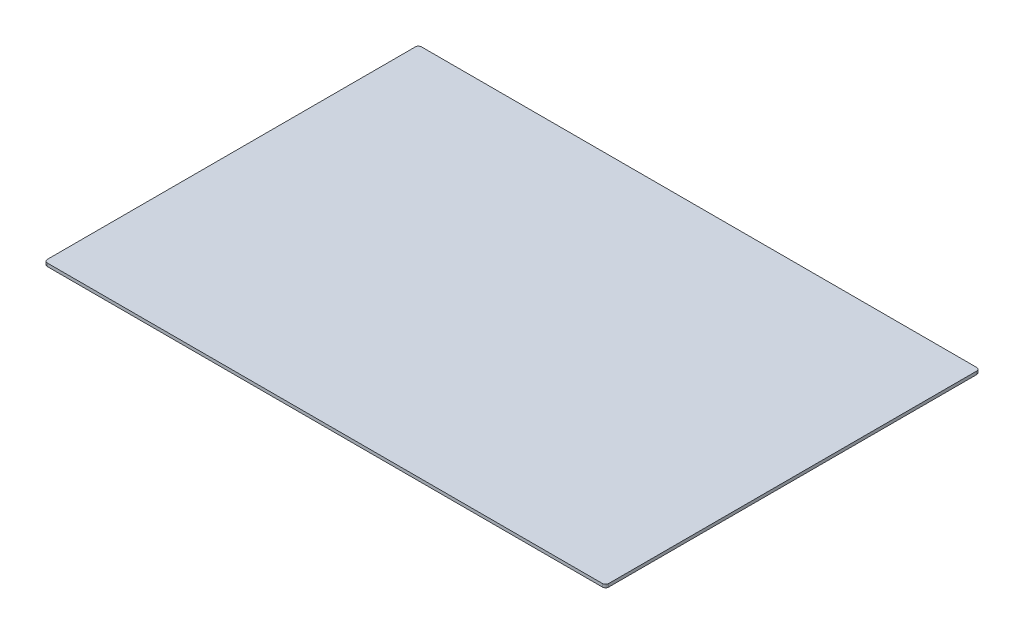
from build123d import *

# Parameters (mm, degrees)
SKETCH1_W           = 900
SKETCH1_H           = 600
BOSS_EXTRUDE1_DEPTH = 5
FILLET2_R           = 5


with BuildPart() as part:
    # Sketch1 → Boss-Extrude1 (new body)
    with BuildSketch(Plane(origin=(0, 0, 0), x_dir=(1, 0, 0), z_dir=(0, 1, 0))):
        with Locations((0, 25)):
            Rectangle(SKETCH1_W, SKETCH1_H)
    extrude(amount=BOSS_EXTRUDE1_DEPTH)

    # Fillet2
    fillet2_edges = [part.edges().sort_by_distance(p)[0] for p in [
        (450, 2.5, 275),
        (-450, 2.5, 275),
        (-450, 2.5, -325),
        (450, 2.5, -325),
    ]]
    fillet(fillet2_edges, radius=FILLET2_R)


solid = part.part
